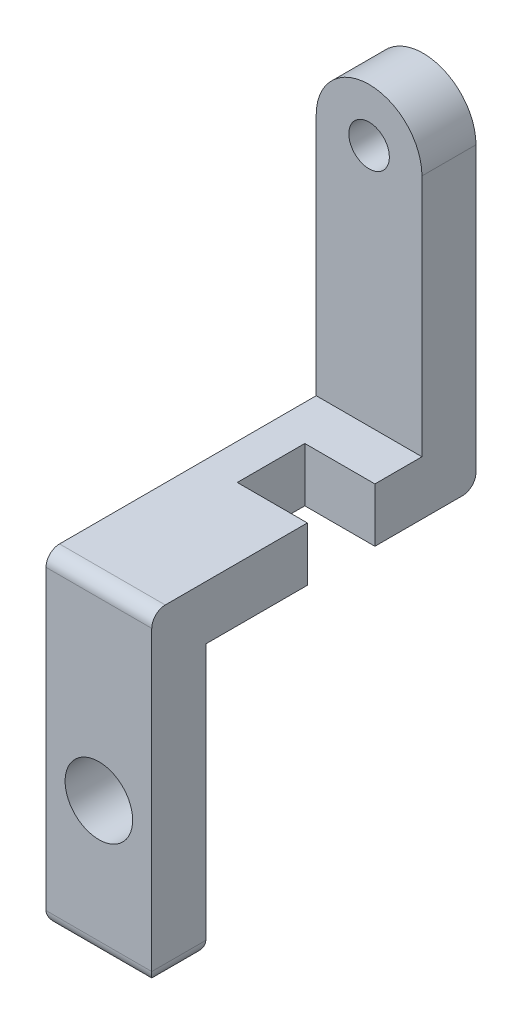
from build123d import *

# Parameters (mm, degrees)
SKICA1_R                 = 1.5
P_IDAT_VYSUNUT_M1_DEPTH  = 4
SKICA2_W                 = 7.826237638
SKICA2_H                 = 4
P_IDAT_VYSUNUT_M2_DEPTH  = 16
SKICA3_W                 = 7.826237638
SKICA3_H                 = 24
SKICA3_R                 = 2.5
P_IDAT_VYSUNUT_M3_DEPTH  = 4
SKICA4_W                 = 5.18826407
SKICA4_H                 = 5
ODEBRAT_VYSUNUT_M1_DEPTH = 4
ZAOBLIT1_R               = 1
ZAOBLIT2_R               = 1


with BuildPart() as part:
    # Skica1 → Přidat vysunutím1 (new body)
    with BuildSketch(Plane.XY):
        with BuildLine():
            Line((108.413118819, 104.5), (108.413118819, 82.5))
            Line((108.413118819, 82.5), (100.586881181, 82.5))
            Line((100.586881181, 82.5), (100.586881181, 104.5))
            ThreePointArc((100.586881181, 104.5), (104.5, 108.413118819), (108.413118819, 104.5))
        make_face()
        with Locations((104.5, 104.5)):
            Circle(SKICA1_R, mode=Mode.SUBTRACT)
    extrude(amount=P_IDAT_VYSUNUT_M1_DEPTH)

    # Skica2 → Přidat vysunutím2 (add)
    with BuildSketch(Plane.XY.offset(4)):
        with Locations((104.5, 84.5)):
            Rectangle(SKICA2_W, SKICA2_H)
    extrude(amount=P_IDAT_VYSUNUT_M2_DEPTH)

    # Skica3 → Přidat vysunutím3 (add)
    with BuildSketch(Plane.XY.offset(20)):
        with Locations((104.5, 74.5)):
            Rectangle(SKICA3_W, SKICA3_H)
        with Locations((104.5, 72.5)):
            Circle(SKICA3_R, mode=Mode.SUBTRACT)
    extrude(amount=P_IDAT_VYSUNUT_M3_DEPTH)

    # Skica4 → Odebrat vysunutím1 (cut)
    with BuildSketch(Plane(origin=(0, 86.5, 0), x_dir=(1, 0, 0), z_dir=(0, 1, 0))):
        with Locations((105.818986784, -9.982223616)):
            Rectangle(SKICA4_W, SKICA4_H)
    extrude(amount=-ODEBRAT_VYSUNUT_M1_DEPTH, mode=Mode.SUBTRACT)

    # Zaoblit1
    zaoblit1_edges = [part.edges().sort_by_distance(p)[0] for p in [
        (104.5, 86.5, 24),
    ]]
    fillet(zaoblit1_edges, radius=ZAOBLIT1_R)

    # Zaoblit2
    zaoblit2_edges = [part.edges().sort_by_distance(p)[0] for p in [
        (104.5, 62.5, 24),
        (104.5, 62.5, 20),
        (100.586881181, 62.5, 22),
        (108.413118819, 62.5, 22),
        (104.5, 82.5, 0),
    ]]
    fillet(zaoblit2_edges, radius=ZAOBLIT2_R)


solid = part.part
